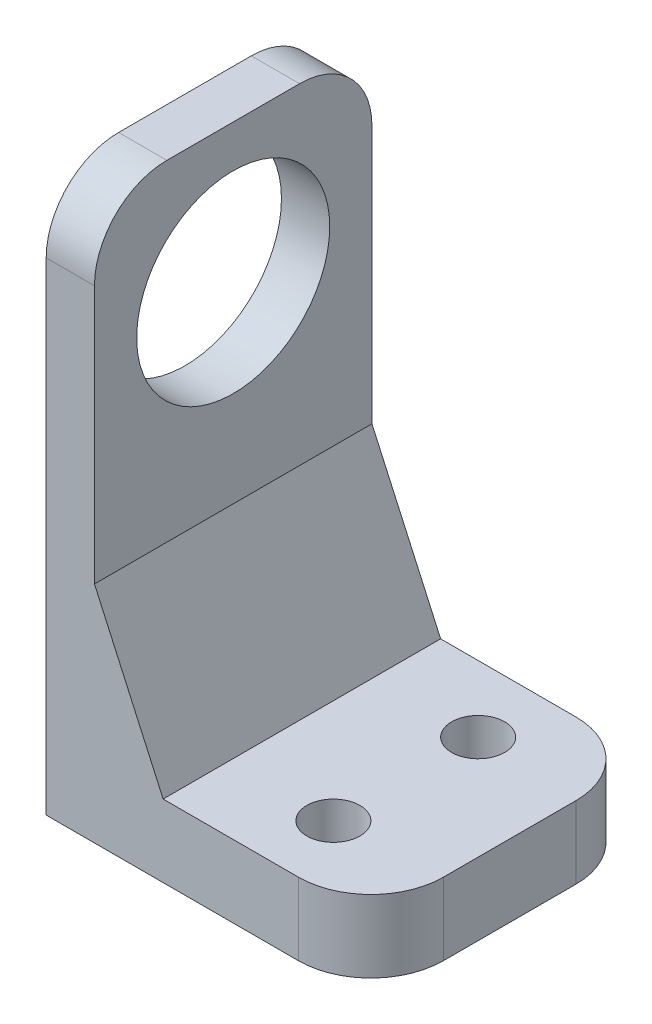
from build123d import *

# Parameters (mm, degrees)
SKETCH_1_W          = 49.901037986
SKETCH_1_H          = 11.5
EXTRUDE_1_DEPTH     = 3
SKETCH_3_W          = 11.5
SKETCH_3_H          = 23
EXTRUDE_2_DEPTH     = 2
SKETCH_4_R          = 4
CUT_EXTRUDE_1_DEPTH = 3
SKETCH_7_W          = 44.527674248
SKETCH_7_H          = 38.163809885
CUT_EXTRUDE_2_DEPTH = 10
EXTRUDE_3_DEPTH     = 11.5
SKETCH_9_R          = 1.1
CUT_EXTRUDE_3_DEPTH = 10
FILLET_2_R          = 3
FILLET_3_R          = 3


with BuildPart() as part:
    # 草图1 → 凸台-拉伸1 (new body)
    with BuildSketch(Plane(origin=(0, 0, 0), x_dir=(1, 0, 0), z_dir=(0, 1, 0))):
        Rectangle(SKETCH_1_W, SKETCH_1_H)
    extrude(amount=EXTRUDE_1_DEPTH)

    # 草图3 → 凸台-拉伸2 (add)
    with BuildSketch(Plane.ZY.offset(24.950518993)):
        with Locations((0, 11.5)):
            Rectangle(SKETCH_3_W, SKETCH_3_H)
    extrude(amount=-EXTRUDE_2_DEPTH)

    # 草图4 → 切除-拉伸1 (cut)
    with BuildSketch(Plane(origin=(-22.950518993, 0, 0), x_dir=(0, 0, -1), z_dir=(1, 0, 0))):
        with Locations((0, 17.25)):
            Circle(SKETCH_4_R)
    extrude(amount=-CUT_EXTRUDE_1_DEPTH, mode=Mode.SUBTRACT)

    # 草图7 → 切除-拉伸2 (cut)
    with BuildSketch(Plane(origin=(0, 3, 0), x_dir=(1, 0, 0), z_dir=(0, 1, 0))):
        with Locations((10.77056276, -2.40663606)):
            Rectangle(SKETCH_7_W, SKETCH_7_H)
    extrude(amount=-CUT_EXTRUDE_2_DEPTH, mode=Mode.SUBTRACT)

    # 草图8 → 凸台-拉伸3 (add)
    with BuildSketch(Plane.XY.offset(5.75)):
        Polygon((-22.950518993, 9.295590995), (-22.950518993, 3), (-20.10387752, 3), align=None)
    extrude(amount=-EXTRUDE_3_DEPTH)

    # 草图9 → 切除-拉伸3 (cut)
    with BuildSketch(Plane(origin=(0, 3, 0), x_dir=(1, 0, 0), z_dir=(0, 1, 0))):
        with Locations(Location((-15.798575942, 3, 0), (0, 0, 270))):
            Circle(SKETCH_9_R)
        with Locations(Location((-15.798575942, -3, 0), (0, 0, 270))):
            Circle(SKETCH_9_R)
    extrude(amount=-CUT_EXTRUDE_3_DEPTH, mode=Mode.SUBTRACT)

    # 圆角2
    fillet_2_edges = [part.edges().sort_by_distance(p)[0] for p in [
        (-23.950518993, 23, -5.75),
        (-23.950518993, 23, 5.75),
    ]]
    fillet(fillet_2_edges, radius=FILLET_2_R)

    # 圆角3
    fillet_3_edges = [part.edges().sort_by_distance(p)[0] for p in [
        (-11.493274364, 1.5, 5.75),
        (-11.493274364, 1.5, -5.75),
    ]]
    fillet(fillet_3_edges, radius=FILLET_3_R)


solid = part.part
